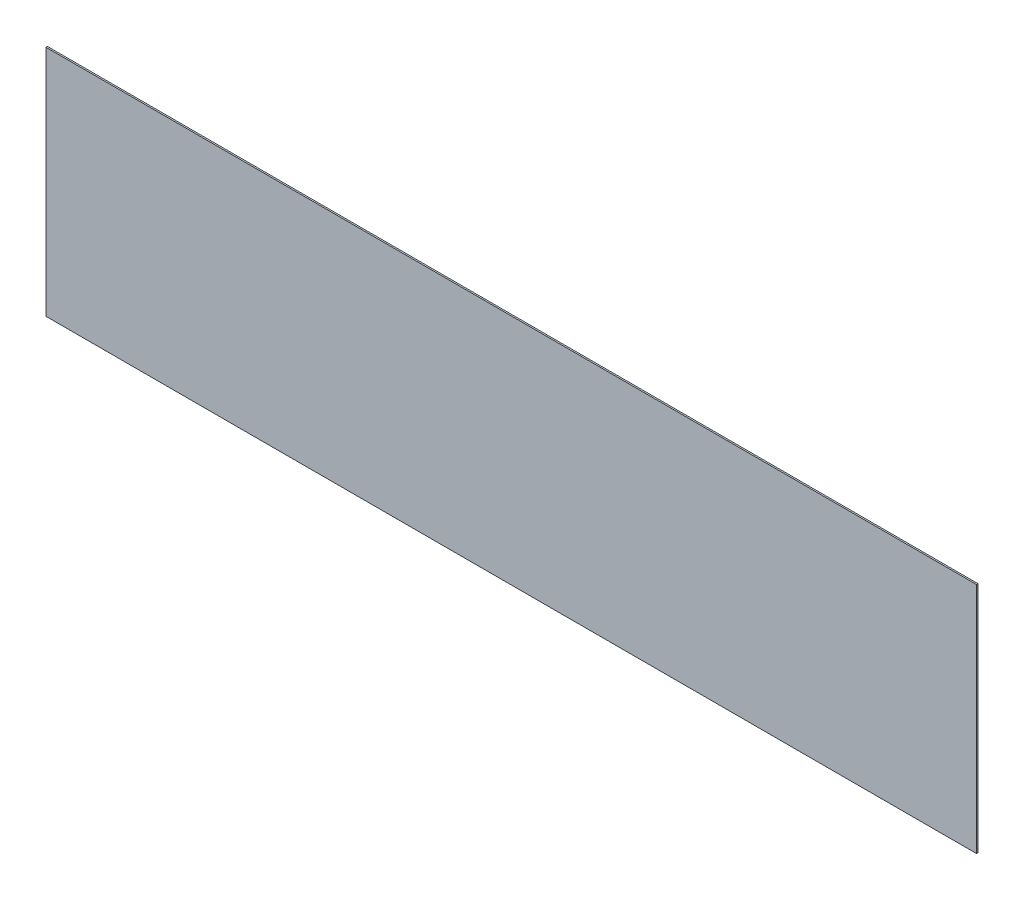
from build123d import *

# Parameters (mm, degrees)
SKETCH1_W           = 1242
SKETCH1_H           = 311
BOSS_EXTRUDE1_DEPTH = 2


with BuildPart() as part:
    # Sketch1 → Boss-Extrude1 (new body)
    with BuildSketch(Plane.XY):
        with Locations((621, 155.5)):
            Rectangle(SKETCH1_W, SKETCH1_H)
    extrude(amount=BOSS_EXTRUDE1_DEPTH)


solid = part.part
